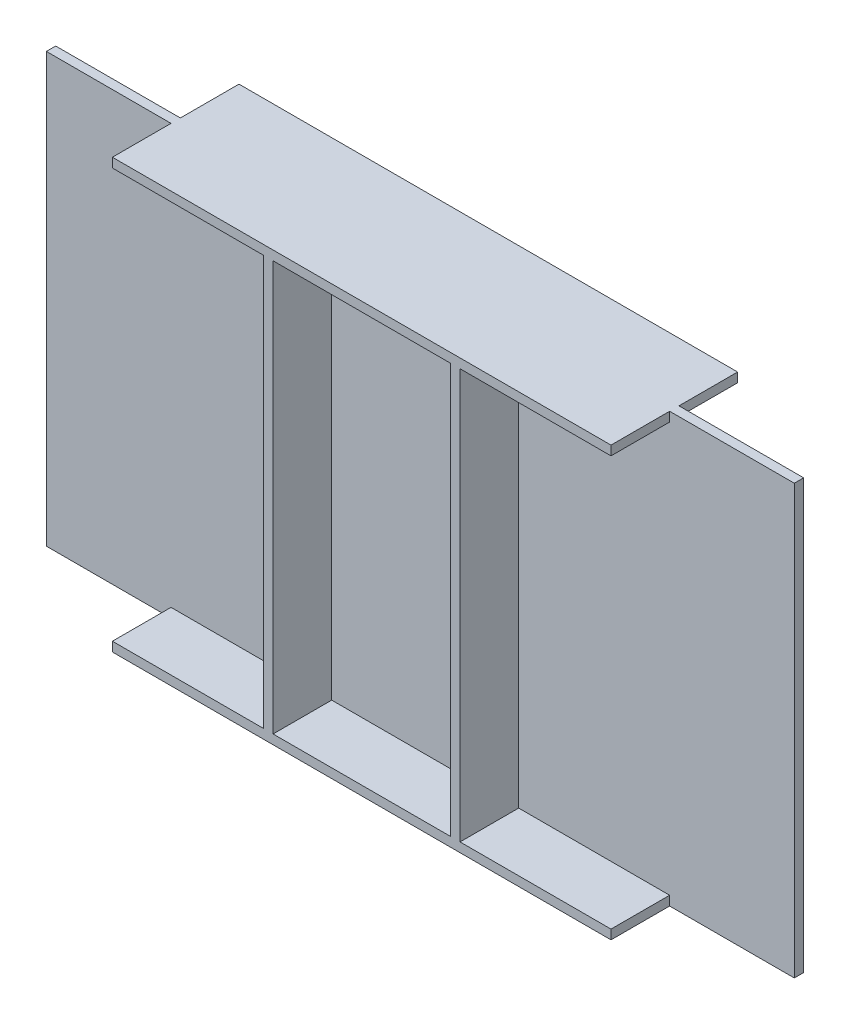
from build123d import *

# Parameters (mm, degrees)
SKETCH_1_W      = 960
SKETCH_1_H      = 550
EXTRUDE_1_DEPTH = 12
SKETCH_2_W      = 640
SKETCH_2_H      = 162.5
EXTRUDE_2_DEPTH = 12
SKETCH_3_W      = 640
SKETCH_3_H      = 162.5
EXTRUDE_3_DEPTH = 12
SKETCH_4_W      = 12.5
SKETCH_4_H      = 526
EXTRUDE_4_DEPTH = 162.5


with BuildPart() as part:
    # 草图1 → 凸台-拉伸1 (new body)
    with BuildSketch(Plane.XY):
        with Locations((480, 275)):
            Rectangle(SKETCH_1_W, SKETCH_1_H)
    extrude(amount=EXTRUDE_1_DEPTH)

    # 草图2 → 凸台-拉伸2 (add)
    with BuildSketch(Plane(origin=(0, 550, 0), x_dir=(1, 0, 0), z_dir=(0, 1, 0))):
        with Locations((480, -6)):
            Rectangle(SKETCH_2_W, SKETCH_2_H)
    extrude(amount=-EXTRUDE_2_DEPTH)

    # 草图3 → 凸台-拉伸3 (add)
    with BuildSketch(Plane.XZ):
        with Locations((480, 6)):
            Rectangle(SKETCH_3_W, SKETCH_3_H)
    extrude(amount=-EXTRUDE_3_DEPTH)

    # 草图4 → 凸台-拉伸4 (add)
    with BuildSketch(Plane(origin=(0, 0, -75.25), x_dir=(-1, 0, 0), z_dir=(0, 0, -1))):
        with Locations((-600, 275)):
            Rectangle(SKETCH_4_W, SKETCH_4_H)
        with Locations((-360, 275)):
            Rectangle(SKETCH_4_W, SKETCH_4_H)
    extrude(amount=-EXTRUDE_4_DEPTH)


solid = part.part
